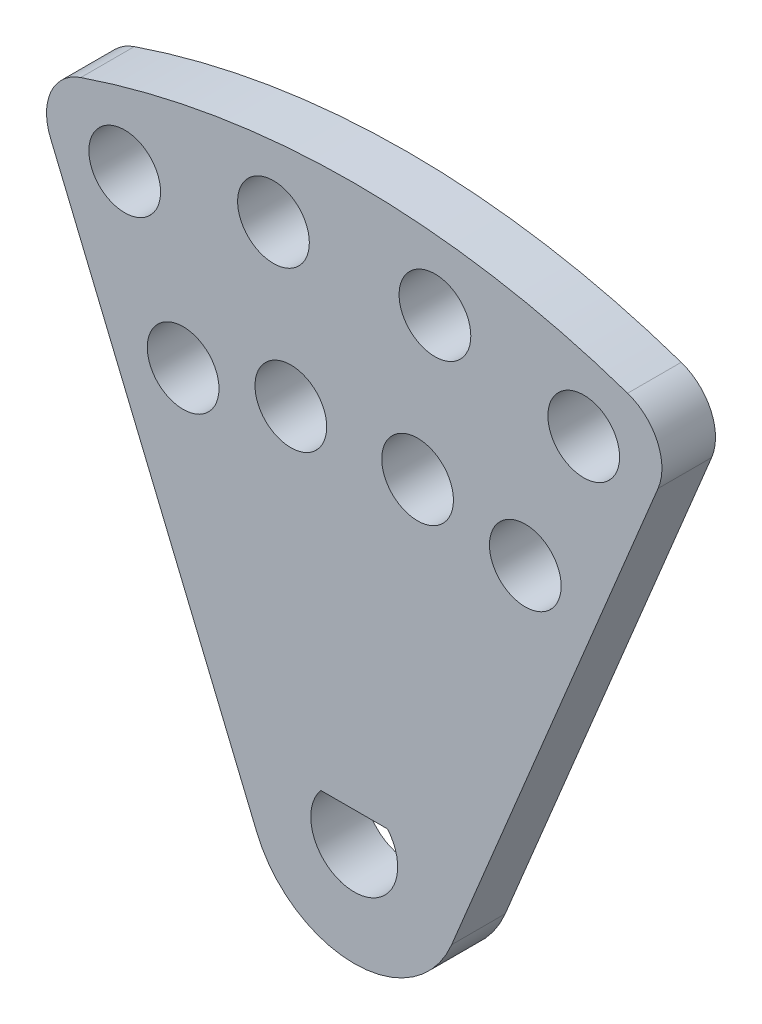
from build123d import *

# Parameters (mm, degrees)
SKETCH2_R           = 4.25
BOSS_EXTRUDE1_DEPTH = 6.35
FILLET1_R           = 6


with BuildPart() as part:
    # Sketch2 → Boss-Extrude1 (new body)
    with BuildSketch(Plane.XY):
        with BuildLine():
            Line((11.548494156, -4.783542905), (38.382716246, 60))
            ThreePointArc((38.382716246, 60), (0, 67.634796955), (-38.382716246, 60))
            Line((-38.382716246, 60), (-11.548494156, -4.783542905))
            ThreePointArc((-11.548494156, -4.783542905), (0, -12.5), (11.548494156, -4.783542905))
        make_face()
        with Locations((-27.203312061, 55.222101201)):
            Circle(SKETCH2_R, mode=Mode.SUBTRACT)
        with Locations((-9.56999846, 58.836828221)):
            Circle(SKETCH2_R, mode=Mode.SUBTRACT)
        with Locations((9.56999846, 58.836828221)):
            Circle(SKETCH2_R, mode=Mode.SUBTRACT)
        with Locations((27.203312061, 55.222101201)):
            Circle(SKETCH2_R, mode=Mode.SUBTRACT)
        with Locations((-20.278160914, 38.503307381)):
            Circle(SKETCH2_R, mode=Mode.SUBTRACT)
        with Locations((-7.511195711, 40.953735809)):
            Circle(SKETCH2_R, mode=Mode.SUBTRACT)
        with Locations((7.511195711, 40.953735809)):
            Circle(SKETCH2_R, mode=Mode.SUBTRACT)
        with Locations((20.278160914, 38.503307381)):
            Circle(SKETCH2_R, mode=Mode.SUBTRACT)
        with BuildLine():
            Line((-3.953795645, 3.3), (3.953795645, 3.3))
            ThreePointArc((3.953795645, 3.3), (0, -5.15), (-3.953795645, 3.3))
        make_face(mode=Mode.SUBTRACT)
    extrude(amount=BOSS_EXTRUDE1_DEPTH)

    # Fillet1
    fillet1_edges = [part.edges().sort_by_distance(p)[0] for p in [
        (-38.382716246, 60, 3.175),
        (38.382716246, 60, 3.175),
    ]]
    fillet(fillet1_edges, radius=FILLET1_R)


solid = part.part
